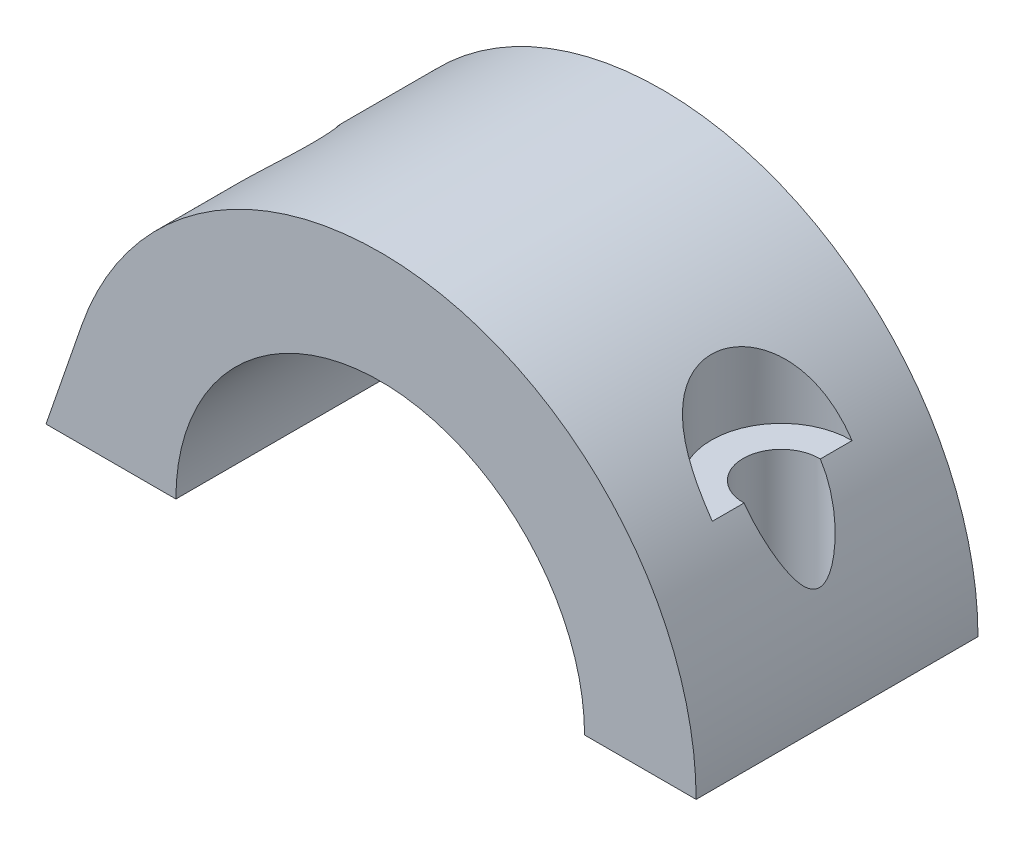
from build123d import *

# Parameters (mm, degrees)
BOSS_EXTRUDE1_DEPTH = 11.09
SKETCH3_R           = 1.5
CUT_EXTRUDE4_DEPTH  = 10
SKETCH4_R           = 2.75
CUT_EXTRUDE3_DEPTH  = 2.5


with BuildPart() as part:
    # Sketch1 → Boss-Extrude1 (new body)
    with BuildSketch(Plane.XY):
        with BuildLine():
            Line((-8.04, 0), (-13.15, 0))
            Line((-13.15, 0), (-11.749422053, 4.05659727))
            ThreePointArc((-11.749422053, 4.05659727), (2.056645798, 12.258674809), (12.43, 0))
            Line((12.43, 0), (8.04, 0))
            ThreePointArc((8.04, 0), (5.685138521, 5.685138521), (0, 8.04))
            ThreePointArc((0, 8.04), (-5.685138521, 5.685138521), (-8.04, 0))
        make_face()
    extrude(amount=BOSS_EXTRUDE1_DEPTH)

    # Sketch3 → Cut-Extrude4 (cut)
    with BuildSketch(Plane.XZ):
        with Locations((-10.595, 5.95)):
            Circle(SKETCH3_R)
        with Locations((10.235, 5.545)):
            Circle(SKETCH3_R)
    extrude(amount=-CUT_EXTRUDE4_DEPTH, mode=Mode.SUBTRACT)

    # Sketch4 → Cut-Extrude3 (cut, symmetric)
    with BuildSketch(Plane(origin=(0, 9.5, 0), x_dir=(1, 0, 0), z_dir=(0, 1, 0))):
        with Locations((-10.595, -5.95)):
            Circle(SKETCH4_R)
        with Locations((10.235, -5.545)):
            Circle(SKETCH4_R)
    extrude(amount=CUT_EXTRUDE3_DEPTH, both=True, mode=Mode.SUBTRACT)


solid = part.part
